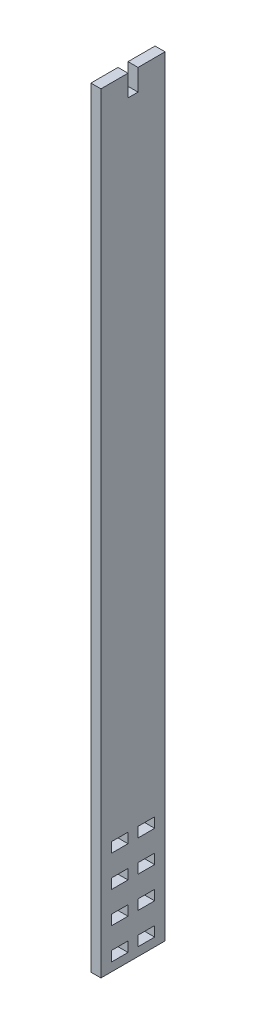
from build123d import *

# Parameters (mm, degrees)
SKETCH1_W           = 228.6
SKETCH1_H           = 19.05
BOSS_EXTRUDE1_DEPTH = 2.9718
SKETCH3_W           = 6.35
SKETCH3_H           = 2.9718
CUT_EXTRUDE1_DEPTH  = 115.734681854
SKETCH4_W           = 2.9718
SKETCH4_H           = 4.8641
SKETCH4_H_2         = 4.944612775
CUT_EXTRUDE2_DEPTH  = 115.734681854


with BuildPart() as part:
    # Sketch1 → Boss-Extrude1 (new body)
    with BuildSketch(Plane.YZ):
        Rectangle(SKETCH1_W, SKETCH1_H)
    extrude(amount=BOSS_EXTRUDE1_DEPTH)

    # Sketch3 → Cut-Extrude1 (cut, through all)
    with BuildSketch(Plane.YZ.offset(2.9718)):
        with Locations((111.125, 0)):
            Rectangle(SKETCH3_W, SKETCH3_H)
    extrude(amount=-CUT_EXTRUDE1_DEPTH, mode=Mode.SUBTRACT)

    # Sketch4 → Cut-Extrude2 (cut, through all)
    with BuildSketch(Plane.YZ.offset(2.9718)):
        with Locations((-100.9523, 3.91795)):
            Rectangle(SKETCH4_W, SKETCH4_H)
        with Locations((-110.2741, 3.91795)):
            Rectangle(SKETCH4_W, SKETCH4_H)
        with Locations((-110.2741, -3.958206388)):
            Rectangle(SKETCH4_W, SKETCH4_H_2)
        with Locations((-100.9523, -3.958206388)):
            Rectangle(SKETCH4_W, SKETCH4_H_2)
        with Locations((-91.6305, 3.91795)):
            Rectangle(SKETCH4_W, SKETCH4_H)
        with Locations((-91.6305, -3.958206388)):
            Rectangle(SKETCH4_W, SKETCH4_H_2)
        with Locations((-82.3087, 3.91795)):
            Rectangle(SKETCH4_W, SKETCH4_H)
        with Locations((-82.3087, -3.958206388)):
            Rectangle(SKETCH4_W, SKETCH4_H_2)
    extrude(amount=-CUT_EXTRUDE2_DEPTH, mode=Mode.SUBTRACT)


solid = part.part
